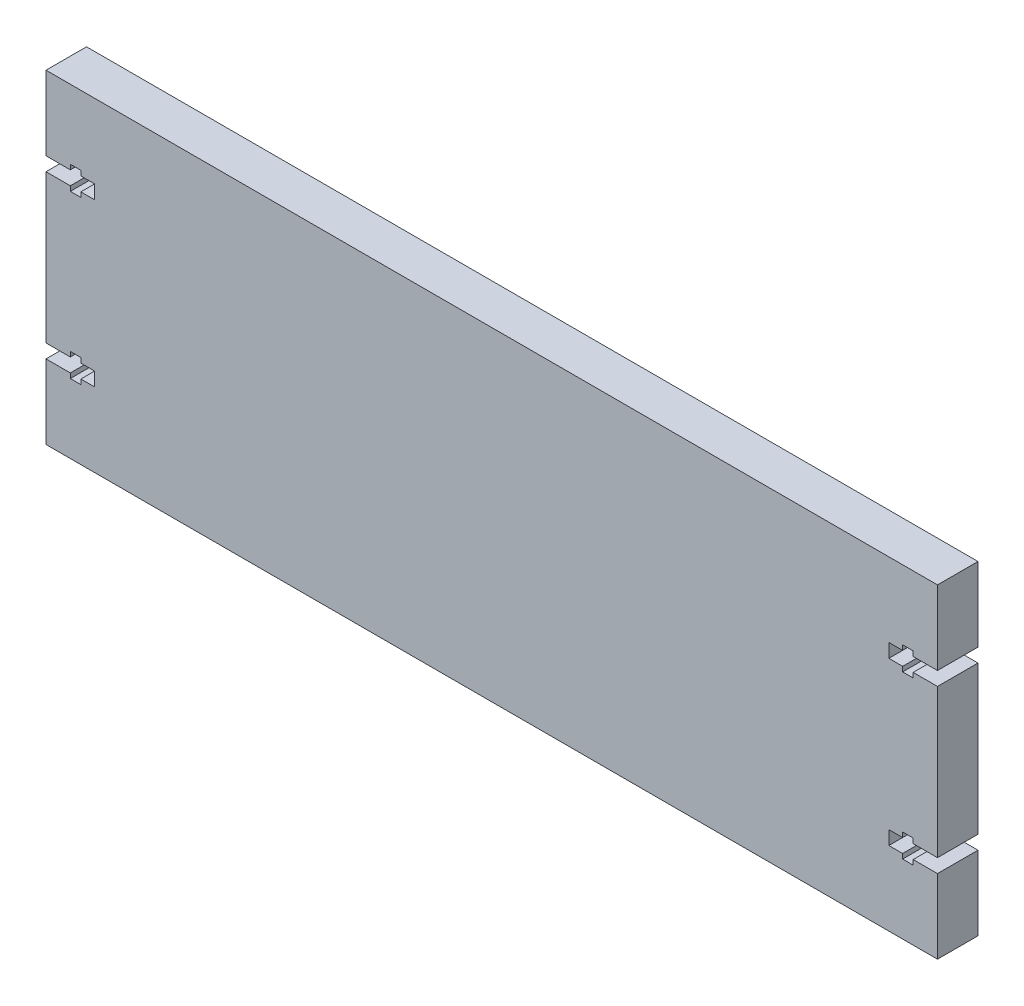
from build123d import *

# Parameters (mm, degrees)
SKETCH1_W           = 279.4
SKETCH1_H           = 101.6
BOSS_EXTRUDE1_DEPTH = 12.7
CUT_EXTRUDE1_DEPTH  = 298.570512652


with BuildPart() as part:
    # Sketch1 → Boss-Extrude1 (new body)
    with BuildSketch(Plane.XY):
        with Locations((139.7, 50.8)):
            Rectangle(SKETCH1_W, SKETCH1_H)
    extrude(amount=BOSS_EXTRUDE1_DEPTH)

    # Sketch2 → Cut-Extrude1 (cut, through all)
    with BuildSketch(Plane.XY.offset(12.7)):
        Polygon((279.4, 78.359), (279.4, 74.041), (271.78, 74.041), (271.78, 72.517), (268.478, 72.517), (268.478, 74.041), (264.16, 74.041), (264.16, 78.359), (268.478, 78.359), (268.478, 79.883), (271.78, 79.883), (271.78, 78.359), align=None)
        Polygon((271.78, 23.241), (279.4, 23.241), (279.4, 27.559), (271.78, 27.559), (271.78, 29.083), (268.478, 29.083), (268.478, 27.559), (264.16, 27.559), (264.16, 23.241), (268.478, 23.241), (268.478, 21.717), (271.78, 21.717), align=None)
        Polygon((0, 23.241), (0, 27.559), (7.62, 27.559), (7.62, 29.083), (10.922, 29.083), (10.922, 27.559), (15.24, 27.559), (15.24, 23.241), (10.922, 23.241), (10.922, 21.717), (7.62, 21.717), (7.62, 23.241), align=None)
        Polygon((7.62, 78.359), (0, 78.359), (0, 74.041), (7.62, 74.041), (7.62, 72.517), (10.922, 72.517), (10.922, 74.041), (15.24, 74.041), (15.24, 78.359), (10.922, 78.359), (10.922, 79.883), (7.62, 79.883), align=None)
    extrude(amount=-CUT_EXTRUDE1_DEPTH, mode=Mode.SUBTRACT)


solid = part.part
